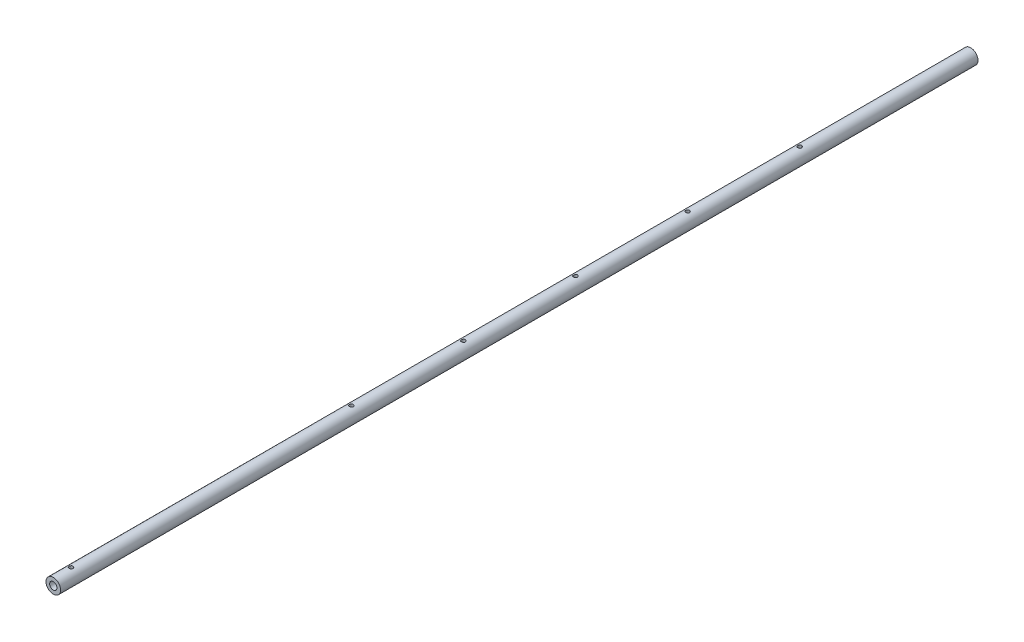
from build123d import *

# Parameters (mm, degrees)
SKETCH1_R        = 7.8613
SKETCH1_R_2      = 3.93065
ROD_DEPTH        = 987.425
HOLES_DEPTH      = 988.487585087
HOLES_DEPTH_BACK = 988.487585087
SKETCH3_R        = 2.1082


with BuildPart() as part:
    # Sketch1 → Rod (new body)
    with BuildSketch(Plane.XY):
        Circle(SKETCH1_R)
        Circle(SKETCH1_R_2, mode=Mode.SUBTRACT)
    extrude(amount=ROD_DEPTH)

    # Sketch3 → Holes (cut, two sides: drawn at the far end of the back side and taken through both)
    with BuildSketch(Plane(origin=(0, 0, 0), x_dir=(1, 0, 0), z_dir=(0, 1, 0)).offset(-HOLES_DEPTH_BACK)):
        with Locations(Location((0, -184.15, 0), (0, 0, 270))):
            Circle(SKETCH3_R)
        with Locations(Location((0, -304.8, 0), (0, 0, 270))):
            Circle(SKETCH3_R)
        with Locations(Location((0, -425.45, 0), (0, 0, 270))):
            Circle(SKETCH3_R)
        with Locations(Location((0, -546.1, 0), (0, 0, 270))):
            Circle(SKETCH3_R)
        with Locations(Location((0, -666.75, 0), (0, 0, 270))):
            Circle(SKETCH3_R)
        with Locations(Location((0, -968.375, 0), (0, 0, 270))):
            Circle(SKETCH3_R)
    extrude(amount=HOLES_DEPTH + HOLES_DEPTH_BACK, mode=Mode.SUBTRACT)


solid = part.part
